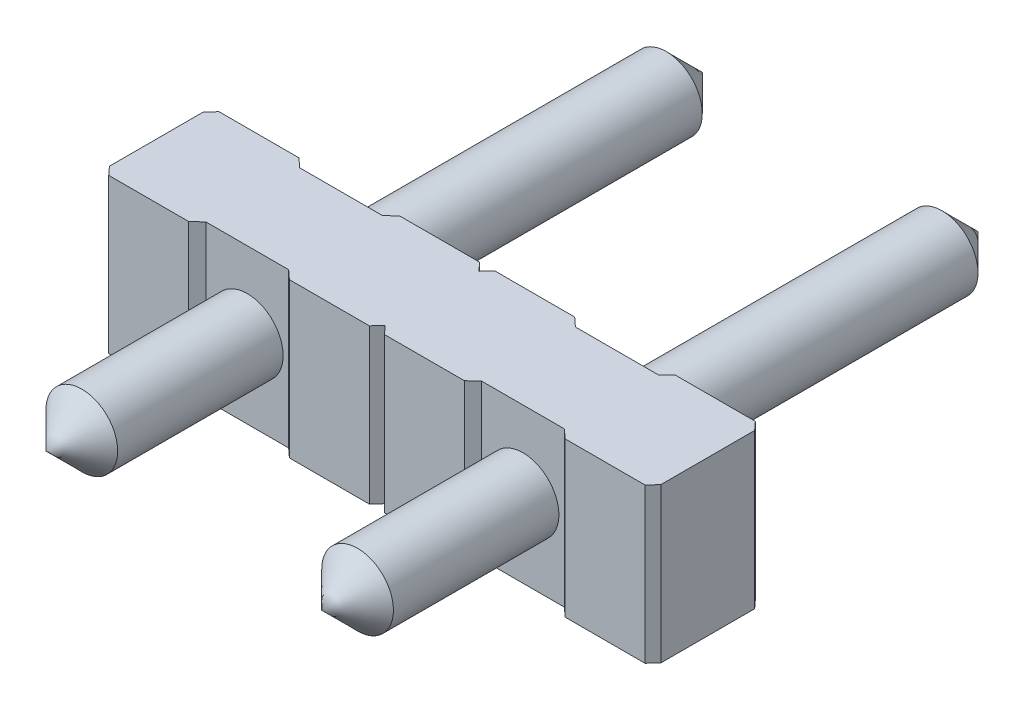
from build123d import *

# Parameters (mm, degrees)
BOSS_EXTRUDE1_DEPTH = 1.4
SKETCH2_R           = 0.65
BOSS_EXTRUDE2_DEPTH = 5.9
BOSS_EXTRUDE3_START = 3
SKETCH3_R           = 0.65
BOSS_EXTRUDE3_DEPTH = 3
SKETCH5_R           = 0.65
BOSS_EXTRUDE4_DEPTH = 0.75
BOSS_EXTRUDE4_TAPER = 45


with BuildPart() as part:
    # Sketch1 → Boss-Extrude1 (new, symmetric)
    with BuildSketch(Plane(origin=(0, 0, 0), x_dir=(1, 0, 0), z_dir=(0, 1, 0))):
        Polygon((-2.5, -0.85), (-2.5, 0.85), (-2.362664546, 1), (-0.913832422, 1), (-0.75, 0.85), (0.75, 0.85), (0.913832422, 1), (2.362664546, 1), (2.5, 0.85), (2.5, -0.85), (2.362664546, -1), (0.913832422, -1), (0.75, -0.85), (-0.75, -0.85), (-0.913832422, -1), (-2.362664546, -1), align=None)
    extrude(amount=BOSS_EXTRUDE1_DEPTH, both=True)

    # Sketch2 → Boss-Extrude2 (add)
    with BuildSketch(Plane(origin=(0, 0, -0.85), x_dir=(-1, 0, 0), z_dir=(0, 0, -1))):
        with Locations(Location((0, 0, 0), (0, 0, 180))):
            Circle(SKETCH2_R)
    extrude(amount=BOSS_EXTRUDE2_DEPTH)

    # Sketch3 → Boss-Extrude3 (add)
    with BuildSketch(Plane.XY.offset(0.85).offset(BOSS_EXTRUDE3_START)):
        Circle(SKETCH3_R)
    extrude(amount=-BOSS_EXTRUDE3_DEPTH)

    # Sketch5 → Boss-Extrude4 (add)
    with BuildSketch(Plane.XY.offset(3.85)):
        Circle(SKETCH5_R)
    extrude(amount=BOSS_EXTRUDE4_DEPTH, taper=BOSS_EXTRUDE4_TAPER)

    # Boss-Extrude5 cone 1 section (through the dimple's axis) → Boss-Extrude5 (revolve)
    with BuildSketch(Plane(origin=(0, 0, -6.75), x_dir=(0, -1, 0), z_dir=(1, 0, 0))):
        Polygon((0, 0), (0.65, 0), (0, 0.65), align=None)
    revolve(axis=Axis((0, 0, -6.75), (0, 0, -1)))

    # Mirror1: part across plane


with BuildPart() as part_1:
    add(part.part)
    add(part.part.mirror(Plane(origin=(-2.5, 1.4, 0.85), x_dir=(0, 0, 1), z_dir=(1, 0, 0))))


solid = part_1.part
